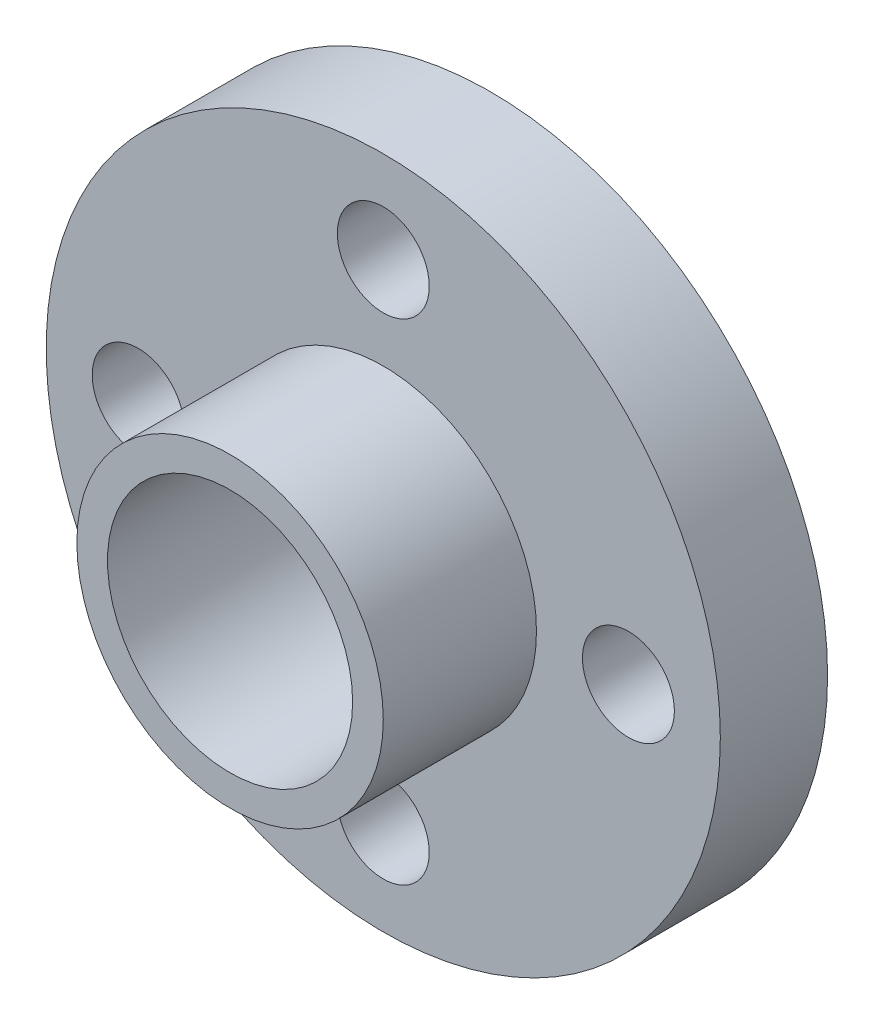
from build123d import *

# Parameters (mm, degrees)
SKETCH_1_R          = 5
EXTRUDE_1_DEPTH     = 2
SKETCH_2_R          = 11
EXTRUDE_2_DEPTH     = 3.5
SKETCH_4_R          = 5
EXTRUDE_3_DEPTH     = 5
SKETCH_5_R          = 1.5
CUT_EXTRUDE_2_DEPTH = 5
SKETCH_6_R          = 4
CUT_EXTRUDE_3_DEPTH = 19.768324379


with BuildPart() as part:
    # 草图1 → 凸台-拉伸1 (new body)
    with BuildSketch(Plane.XY):
        Circle(SKETCH_1_R)
    extrude(amount=EXTRUDE_1_DEPTH)

    # 草图2 → 凸台-拉伸2 (add)
    with BuildSketch(Plane.XY.offset(2)):
        Circle(SKETCH_2_R)
    extrude(amount=EXTRUDE_2_DEPTH)

    # 草图4 → 凸台-拉伸3 (add)
    with BuildSketch(Plane.XY.offset(5.5)):
        Circle(SKETCH_4_R)
    extrude(amount=EXTRUDE_3_DEPTH)

    # 草图5 → 切除-拉伸2 (cut)
    with BuildSketch(Plane.XY.offset(5.5)):
        with Locations((0, 8)):
            Circle(SKETCH_5_R)
        with Locations((8, 0)):
            Circle(SKETCH_5_R)
        with Locations((0, -8)):
            Circle(SKETCH_5_R)
        with Locations((-8, 0)):
            Circle(SKETCH_5_R)
    extrude(amount=-CUT_EXTRUDE_2_DEPTH, mode=Mode.SUBTRACT)

    # 草图6 → 切除-拉伸3 (cut, through all)
    with BuildSketch(Plane.XY.offset(10.5)):
        Circle(SKETCH_6_R)
    extrude(amount=-CUT_EXTRUDE_3_DEPTH, mode=Mode.SUBTRACT)


solid = part.part
